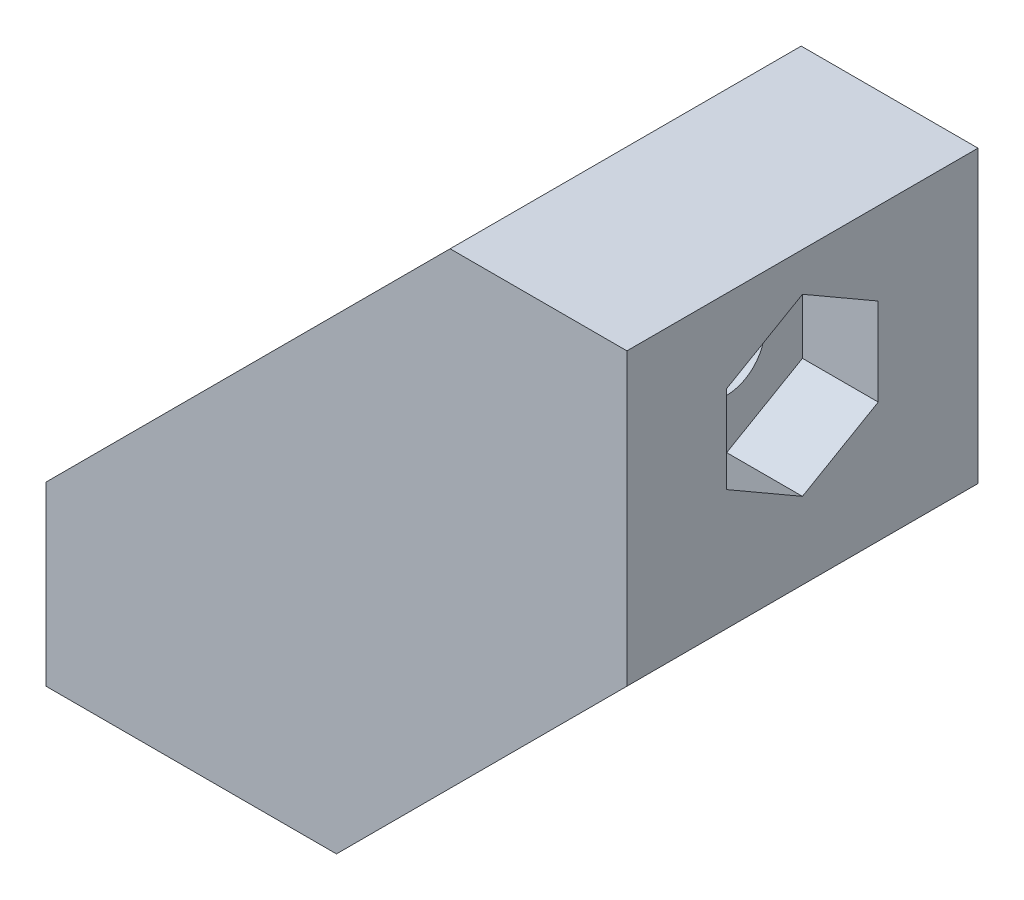
from build123d import *

# Parameters (mm, degrees)
BOSS_EXTRUDE1_DEPTH = 7.9
SKETCH2_R           = 1.5
CUT_EXTRUDE1_DEPTH  = 52.15085532
CUT_EXTRUDE3_DEPTH  = 3
BOSS_EXTRUDE2_DEPTH = 3
BOSS_EXTRUDE3_START = -7.9
BOSS_EXTRUDE3_DEPTH = 3
SKETCH5_W           = 8.304797865
SKETCH5_H           = 8.5
CUT_EXTRUDE4_DEPTH  = 49.987855638


with BuildPart() as part:
    # Sketch1 → Boss-Extrude1 (new body)
    with BuildSketch(Plane.XY):
        Polygon((30, 8), (30, 0), (22, 0), (22, -7), (33.5, -7), (45, 4.5), (45, 16), (38, 16), (38, 8), align=None)
    extrude(amount=-BOSS_EXTRUDE1_DEPTH)

    # Sketch2 → Cut-Extrude1 (cut, through all)
    with BuildSketch(Plane.XZ.offset(7)):
        with Locations((27, -3.95)):
            Circle(SKETCH2_R)
    cut_extrude1 = extrude(amount=-CUT_EXTRUDE1_DEPTH, mode=Mode.SUBTRACT)

    # Sketch3 → Cut-Extrude3 (cut)
    with BuildSketch(Plane(origin=(38, -7, 0), x_dir=(0, 0, -1), z_dir=(0, 1, 0))):
        Polygon((0.95, 12.732050808), (3.95, 14.464101615), (6.95, 12.732050808), (6.95, 9.267949192), (3.95, 7.535898385), (0.95, 9.267949192), align=None)
    cut_extrude3 = extrude(amount=CUT_EXTRUDE3_DEPTH, mode=Mode.SUBTRACT)

    # Sketch4 → Boss-Extrude2 (add)
    with BuildSketch(Plane.XY):
        Polygon((22, 0), (38, 16), (45, 16), (45, 4.5), (33.5, -7), (22, -7), align=None)
    extrude(amount=BOSS_EXTRUDE2_DEPTH)

    # Sketch4<3> → Boss-Extrude3 (add)
    with BuildSketch(Plane.XY.offset(BOSS_EXTRUDE3_START)):
        Polygon((30, 8), (22, 0), (30, 0), align=None)
        Polygon((30, 0), (22, 0), (22, -7), (33.5, -7), (45, 4.5), (45, 16), (38, 16), (38, 8), (30, 8), align=None)
        Polygon((38, 16), (30, 8), (38, 8), align=None)
    extrude(amount=-BOSS_EXTRUDE3_DEPTH)

    # Sketch5 → Cut-Extrude4 (cut, through all)
    with BuildSketch(Plane(origin=(0, 0, 0), x_dir=(1, 0, 0), z_dir=(0, 1, 0))):
        with Locations((26.152398932, 3.95)):
            Rectangle(SKETCH5_W, SKETCH5_H)
    cut_extrude4 = extrude(amount=CUT_EXTRUDE4_DEPTH, mode=Mode.SUBTRACT)

    # Mirror1: Cut-Extrude1, Cut-Extrude3, Cut-Extrude4 across plane
    add(cut_extrude1.mirror(Plane(origin=(19, 19, 0), x_dir=(0, 0, 1), z_dir=(0.707106781186547, 0.707106781186548, 0))), mode=Mode.SUBTRACT)
    add(cut_extrude3.mirror(Plane(origin=(19, 19, 0), x_dir=(0, 0, 1), z_dir=(0.707106781186547, 0.707106781186548, 0))), mode=Mode.SUBTRACT)
    add(cut_extrude4.mirror(Plane(origin=(19, 19, 0), x_dir=(0, 0, 1), z_dir=(0.707106781186547, 0.707106781186548, 0))), mode=Mode.SUBTRACT)


solid = part.part
